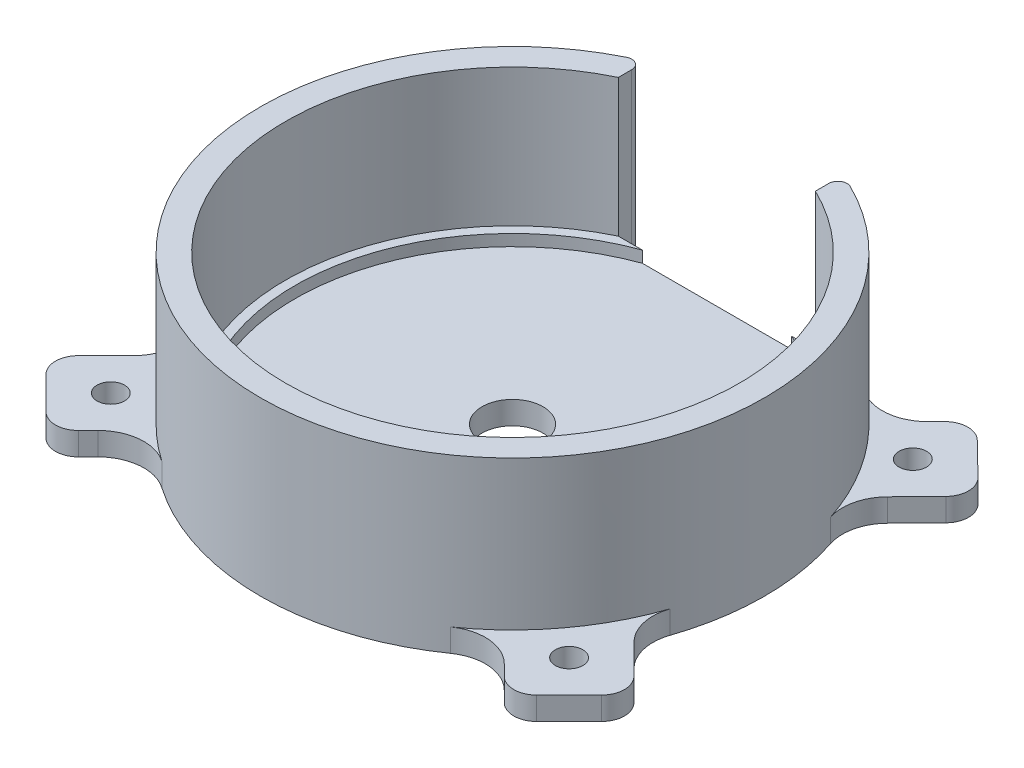
from build123d import *

# Parameters (mm, degrees)
SKETCH_1_R          = 55
EXTRUDE_1_DEPTH     = 37.5
SKETCH_3_R          = 49.5
CUT_EXTRUDE_1_DEPTH = 32.5
SKETCH_5_W          = 43
SKETCH_5_H          = 12.242897151
CUT_EXTRUDE_2_DEPTH = 40
FILLET_4_R          = 2
FILLET_5_R          = 2
SKETCH_6_R          = 6.65
CUT_EXTRUDE_3_DEPTH = 12
EXTRUDE_START       = -5
EXTRUDE_3_DEPTH     = 5
FILLET_7_R          = 10
FILLET_8_R          = 5
SKETCH_10_R         = 3
CUT_EXTRUDE_5_DEPTH = 5
EXTRUDE_START_2     = 2.5
EXTRUDE_4_DEPTH     = 2.5


with BuildPart() as part:
    # 草图1 → 凸台-拉伸1 (new body)
    with BuildSketch(Plane(origin=(0, 0, 0), x_dir=(1, 0, 0), z_dir=(0, 1, 0))):
        with Locations(Location((0, 0, 0), (0, 0, 270))):
            Circle(SKETCH_1_R)
    extrude(amount=EXTRUDE_1_DEPTH)

    # 草图3 → 切除-拉伸1 (cut)
    with BuildSketch(Plane(origin=(0, 37.5, 0), x_dir=(1, 0, 0), z_dir=(0, 1, 0))):
        with Locations(Location((0, 0, 0), (0, 0, 270))):
            Circle(SKETCH_3_R)
    extrude(amount=-CUT_EXTRUDE_1_DEPTH, mode=Mode.SUBTRACT)

    # 草图5 → 切除-拉伸2 (cut)
    with BuildSketch(Plane(origin=(0, 37.5, 0), x_dir=(1, 0, 0), z_dir=(0, 1, 0))):
        with Locations((0, 50.708442195)):
            Rectangle(SKETCH_5_W, SKETCH_5_H)
    extrude(amount=-CUT_EXTRUDE_2_DEPTH, mode=Mode.SUBTRACT)

    # 圆角4
    fillet_4_edges = [part.edges().sort_by_distance(p)[0] for p in [
        (-21.5, 18.75, -50.623611092),
    ]]
    fillet(fillet_4_edges, radius=FILLET_4_R)

    # 圆角5
    fillet_5_edges = [part.edges().sort_by_distance(p)[0] for p in [
        (21.5, 18.75, -50.623611092),
    ]]
    fillet(fillet_5_edges, radius=FILLET_5_R)

    # 草图6 → 切除-拉伸3 (cut)
    with BuildSketch(Plane(origin=(0, 5, 0), x_dir=(1, 0, 0), z_dir=(0, 1, 0))):
        with Locations(Location((0, 0, 0), (0, 0, 270))):
            Circle(SKETCH_6_R)
    extrude(amount=-CUT_EXTRUDE_3_DEPTH, mode=Mode.SUBTRACT)

    # 草图14 → 凸台-拉伸3 (add)
    with BuildSketch(Plane(origin=(0, 5, 0), x_dir=(1, 0, 0), z_dir=(0, 1, 0)).offset(EXTRUDE_START)):
        with BuildLine():
            Line((-49.898576095, 23.132922507), (-63.862525635, 37.044772973))
            Line((-63.862525635, 37.044772973), (-49.746845912, 51.213315099))
            Line((-49.746845912, 51.213315099), (-38.128637352, 39.638453724))
            ThreePointArc((-38.128637352, 39.638453724), (-44.78063998, 31.932652301), (-49.898576095, 23.132922507))
        make_face()
        with BuildLine():
            Line((49.811900188, -23.3189751), (64.421720913, -37.928795825))
            Line((64.421720913, -37.928795825), (50.279585289, -52.070931449))
            Line((50.279585289, -52.070931449), (37.984884655, -39.776230814))
            ThreePointArc((37.984884655, -39.776230814), (44.662950793, -32.097053236), (49.811900188, -23.3189751))
        make_face()
        with BuildLine():
            Line((-49.632393674, -23.698639164), (-63.862550335, -37.928795825))
            Line((-63.862550335, -37.928795825), (-49.720414711, -52.070931449))
            Line((-49.720414711, -52.070931449), (-37.697852746, -40.048369484))
            ThreePointArc((-37.697852746, -40.048369484), (-44.423770724, -32.427281642), (-49.632393674, -23.698639164))
        make_face()
        with BuildLine():
            Line((38.475737251, 39.301623923), (50.118901666, 51.212426922))
            Line((50.118901666, 51.212426922), (64.420808036, 37.231887798))
            Line((64.420808036, 37.231887798), (50.134465219, 22.6171483))
            ThreePointArc((50.134465219, 22.6171483), (45.083643676, 31.50341367), (38.475737251, 39.301623923))
        make_face()
    extrude(amount=EXTRUDE_3_DEPTH)

    # 圆角7
    fillet_7_edges = [part.edges().sort_by_distance(p)[0] for p in [
        (-38.128637352, 2.5, -39.638453724),
        (-49.898576095, 2.5, -23.132922507),
        (-49.632393674, 2.5, 23.698639164),
        (-37.697852746, 2.5, 40.048369484),
        (50.134465219, 2.5, -22.6171483),
        (38.475737251, 2.5, -39.301623923),
        (37.984884655, 2.5, 39.776230814),
        (49.811900188, 2.5, 23.3189751),
    ]]
    fillet(fillet_7_edges, radius=FILLET_7_R)

    # 圆角8
    fillet_8_edges = [part.edges().sort_by_distance(p)[0] for p in [
        (-63.862525635, 2.5, -37.044772973),
        (-49.746845912, 2.5, -51.213315099),
        (-49.720414711, 2.5, 52.070931449),
        (-63.862550335, 2.5, 37.928795825),
        (50.118901666, 2.5, -51.212426922),
        (64.420808036, 2.5, -37.231887798),
        (50.279585289, 2.5, 52.070931449),
        (64.421720913, 2.5, 37.928795825),
    ]]
    fillet(fillet_8_edges, radius=FILLET_8_R)

    # 草图10 → 切除-拉伸5 (cut)
    with BuildSketch(Plane(origin=(0, 5, 0), x_dir=(1, 0, 0), z_dir=(0, 1, 0))):
        with Locations(Location((-49.720414711, 37.071204175, 0), (0, 0, 270))):
            Circle(SKETCH_10_R)
        with Locations(Location((50.279585289, 37.071204175, 0), (0, 0, 270))):
            Circle(SKETCH_10_R)
        with Locations(Location((-49.720414711, -37.928795825, 0), (0, 0, 270))):
            Circle(SKETCH_10_R)
        with Locations(Location((50.279585289, -37.928795825, 0), (0, 0, 270))):
            Circle(SKETCH_10_R)
    extrude(amount=-CUT_EXTRUDE_5_DEPTH, mode=Mode.SUBTRACT)

    # 草图15 → 凸台-拉伸4 (add)
    with BuildSketch(Plane(origin=(0, 5, 0), x_dir=(1, 0, 0), z_dir=(0, 1, 0)).offset(EXTRUDE_START_2)):
        with BuildLine():
            Line((-21.5, 44.586993619), (-16.255768207, 44.586993619))
            ThreePointArc((-16.255768207, 44.586993619), (0, -47.457876059), (16.255768207, 44.586993619))
            Line((16.255768207, 44.586993619), (21.5, 44.586993619))
            ThreePointArc((21.5, 44.586993619), (0, -49.5), (-21.5, 44.586993619))
        make_face()
    extrude(amount=-EXTRUDE_4_DEPTH)


solid = part.part
